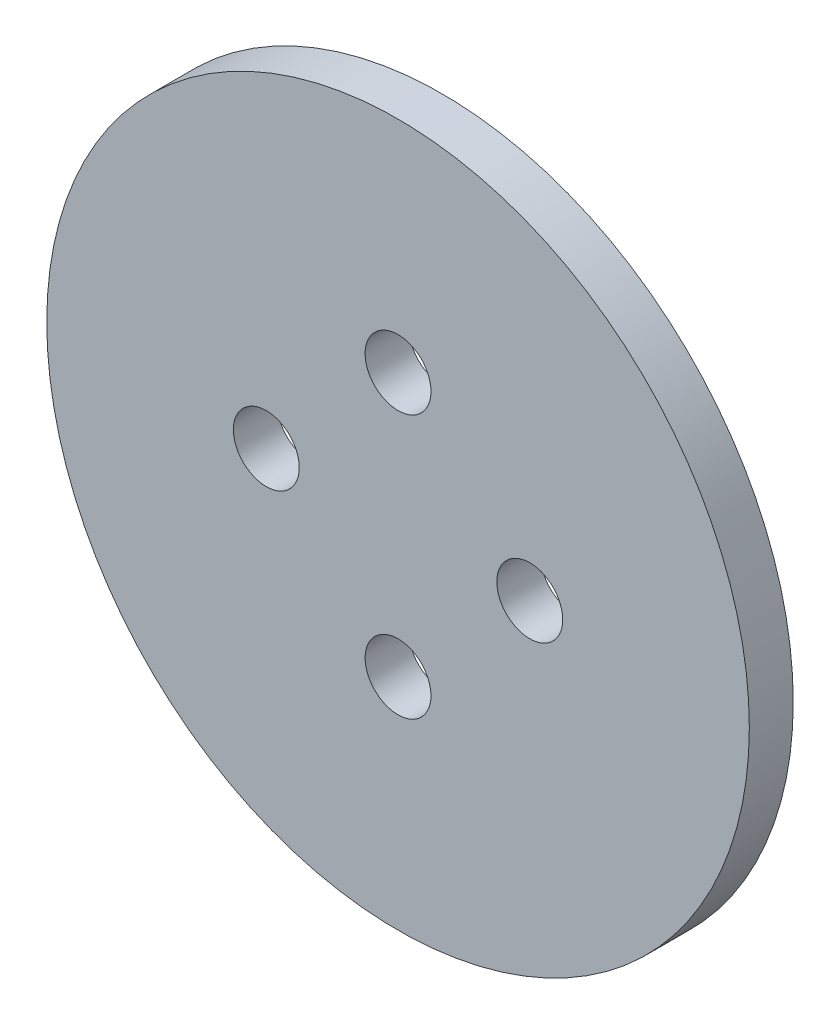
from build123d import *

# Parameters (mm, degrees)
SKETCH1_R           = 25.4
SKETCH1_R_2         = 2.38125
BOSS_EXTRUDE1_DEPTH = 3.175


with BuildPart() as part:
    # Sketch1 → Boss-Extrude1 (new body)
    with BuildSketch(Plane.XY):
        Circle(SKETCH1_R)
        with Locations((0, 9.525)):
            Circle(SKETCH1_R_2, mode=Mode.SUBTRACT)
        with Locations((9.525, 0)):
            Circle(SKETCH1_R_2, mode=Mode.SUBTRACT)
        with Locations((0, -9.525)):
            Circle(SKETCH1_R_2, mode=Mode.SUBTRACT)
        with Locations((-9.525, 0)):
            Circle(SKETCH1_R_2, mode=Mode.SUBTRACT)
    extrude(amount=BOSS_EXTRUDE1_DEPTH)


solid = part.part
